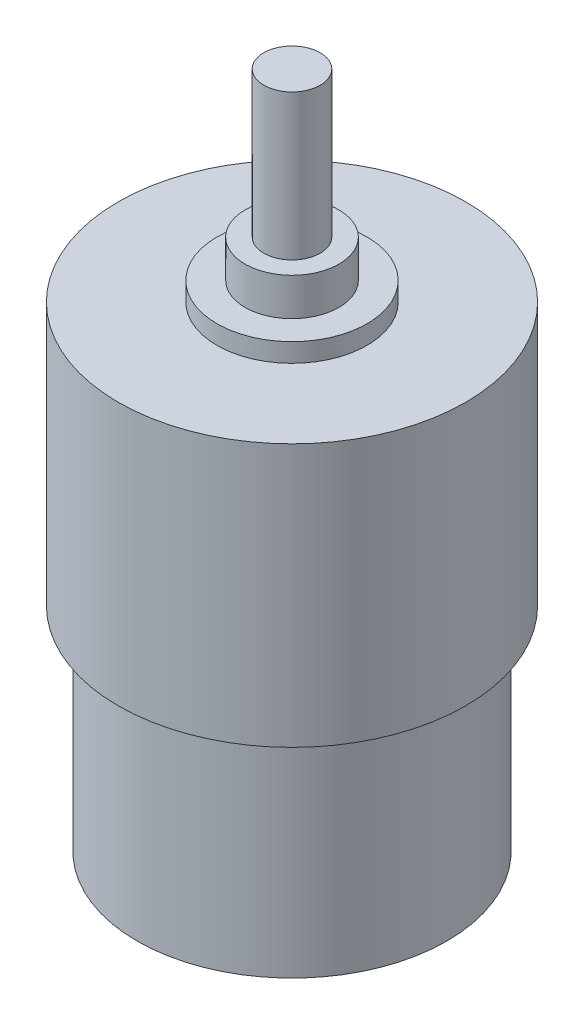
from build123d import *


with BuildPart() as part:
    # Sketch1 → Revolve1 (revolve)
    with BuildSketch(Plane.XY):
        Polygon((0, 0), (16.5, 0), (16.5, 22.7), (18.5, 22.7), (18.5, 50.7), (8, 50.7), (8, 52.7), (5, 52.7), (5, 56.7), (3, 56.7), (3, 72.2), (0, 72.2), align=None)
    revolve(axis=Axis((0, 72.2, 0), (0, -1, 0)))


solid = part.part
